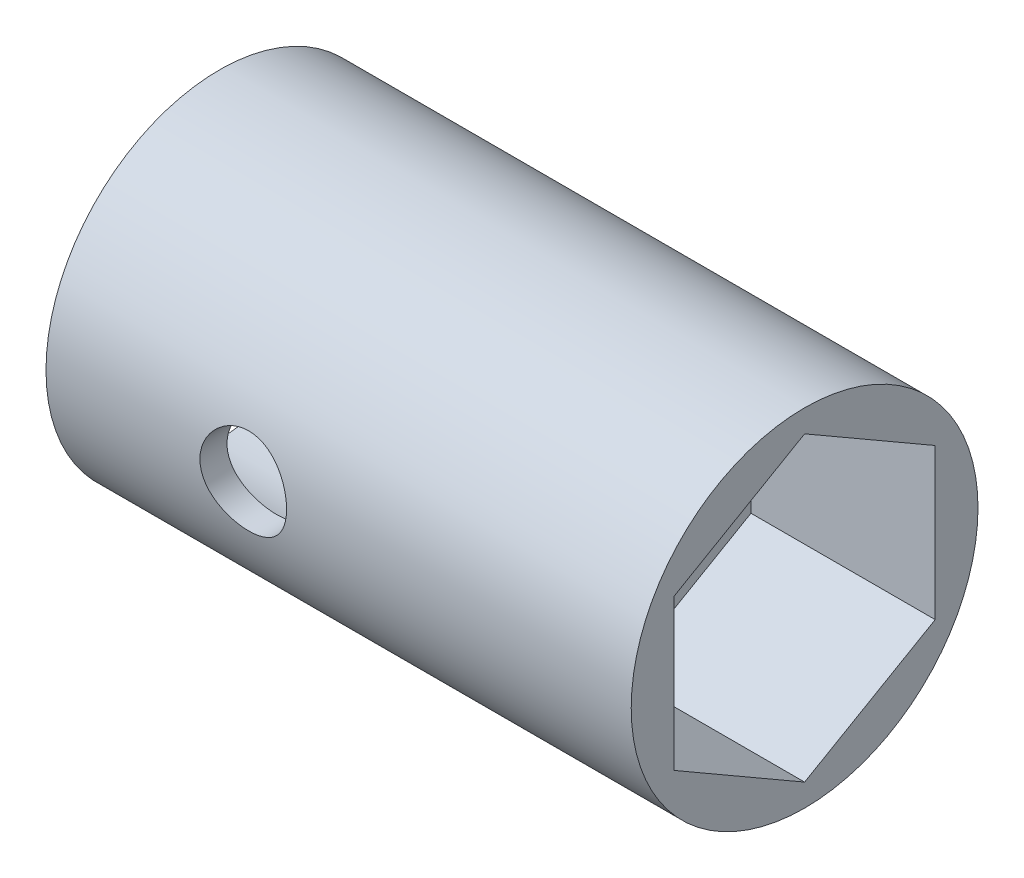
from build123d import *

# Parameters (mm, degrees)
CROQUIS1_R                 = 8
SALIENTE_EXTRUIR1_DEPTH    = 20
CORTAR_EXTRUIR1_DEPTH      = 8.5
CROQUIS3_R                 = 6.75
CORTAR_EXTRUIR2_DEPTH      = 9
CORTAR_EXTRUIR3_REACH      = 17.78
CROQUIS4_R                 = 2.025
CORTAR_EXTRUIR4_DEPTH      = 9
CORTAR_EXTRUIR4_DEPTH_BACK = 23.978250586
CROQUIS5_R                 = 2
SALIENTE_EXTRUIR2_START    = 7
CROQUIS6_R                 = 8
CROQUIS6_R_2               = 6.75
SALIENTE_EXTRUIR2_DEPTH    = 7


with BuildPart() as part:
    # Croquis1 → Saliente-Extruir1 (new body)
    with BuildSketch(Plane(origin=(0, 0, 0), x_dir=(0, 0, -1), z_dir=(1, 0, 0))):
        Circle(CROQUIS1_R)
    extrude(amount=SALIENTE_EXTRUIR1_DEPTH)

    # Croquis2 → Cortar-Extruir1 (cut)
    with BuildSketch(Plane(origin=(20, 0, 0), x_dir=(0, 0, -1), z_dir=(1, 0, 0))):
        Polygon((0, -6.957070744), (6.025, -3.478535372), (6.025, 3.478535372), (0, 6.957070744), (-6.025, 3.478535372), (-6.025, -3.478535372), align=None)
    extrude(amount=-CORTAR_EXTRUIR1_DEPTH, mode=Mode.SUBTRACT)

    # Croquis3 → Cortar-Extruir2 (cut)
    with BuildSketch(Plane.ZY):
        Circle(CROQUIS3_R)
    extrude(amount=-CORTAR_EXTRUIR2_DEPTH, mode=Mode.SUBTRACT)

    # Croquis4 → Cortar-Extruir3 (cut, up to next)
    with BuildSketch(Plane.ZY.offset(-9), mode=Mode.PRIVATE) as cortar_extruir3_sk1:
        Circle(CROQUIS4_R)
    cortar_extruir3_tool1 = extrude(cortar_extruir3_sk1.sketch, amount=-CORTAR_EXTRUIR3_REACH, mode=Mode.PRIVATE) & part.part
    add(cortar_extruir3_tool1.solids().sort_by_distance((9, 0, 0))[0], mode=Mode.SUBTRACT)

    # Croquis5 → Cortar-Extruir4 (cut, two sides: drawn at the far end of the back side and taken through both)
    with BuildSketch(Plane.XY.offset(-CORTAR_EXTRUIR4_DEPTH_BACK)):
        with Locations(Location((2.1, 0, 0), (0, 0, 180))):
            Circle(CROQUIS5_R)
    extrude(amount=CORTAR_EXTRUIR4_DEPTH + CORTAR_EXTRUIR4_DEPTH_BACK, mode=Mode.SUBTRACT)

    # Croquis6 → Saliente-Extruir2 (add)
    with BuildSketch(Plane.ZY.offset(SALIENTE_EXTRUIR2_START)):
        Circle(CROQUIS6_R)
        Circle(CROQUIS6_R_2, mode=Mode.SUBTRACT)
    extrude(amount=-SALIENTE_EXTRUIR2_DEPTH)


solid = part.part
